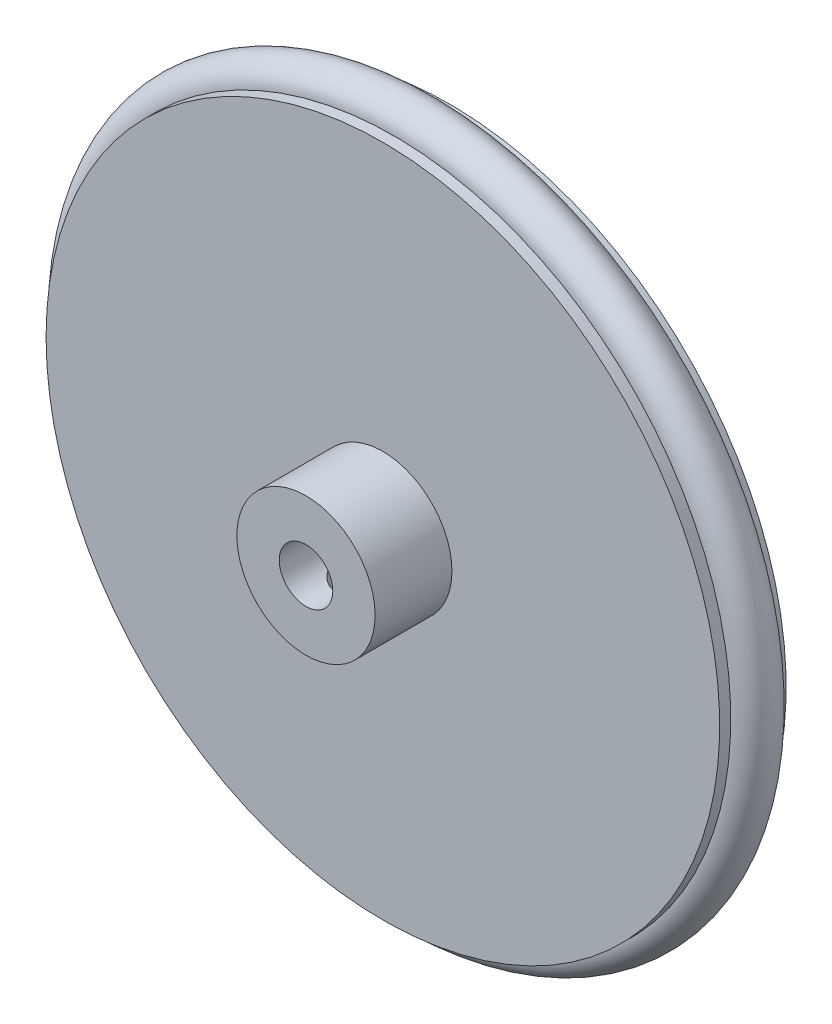
from build123d import *

# Parameters (mm, degrees)
SKETCH1_R           = 39
BOSS_EXTRUDE1_DEPTH = 3.85
SKETCH2_R           = 2.5
SKETCH4_R           = 8
BOSS_EXTRUDE2_DEPTH = 8.9
SKETCH5_R           = 3.1
CUT_EXTRUDE1_DEPTH  = 15.6
SKETCH6_R           = 2
CUT_EXTRUDE2_DEPTH  = 57.608855314
SKETCH3_R           = 2.561236926


with BuildPart() as part:
    # Sketch1 → Boss-Extrude1 (new, symmetric)
    with BuildSketch(Plane.XY):
        with Locations(Location((0, 0, 0), (0, 0, 180))):
            Circle(SKETCH1_R)
    extrude(amount=BOSS_EXTRUDE1_DEPTH, both=True)

    # Cut-Sweep1: sweep along a curve in space
    with BuildLine() as cut_sweep1_path:
        ThreePointArc((39, 0, -3.85), (27.577164466, 27.577164466, -3.85), (0, 39, -3.85))
        ThreePointArc((0, 39, -3.85), (-27.577164466, 27.577164466, -3.85), (-39, 0, -3.85))
        ThreePointArc((-39, 0, -3.85), (-27.577164466, -27.577164466, -3.85), (0, -39, -3.85))
        ThreePointArc((0, -39, -3.85), (27.577164466, -27.577164466, -3.85), (39, 0, -3.85))
    # Sketch2 → Cut-Sweep1 (sweep, cut)
    with BuildSketch(Plane(origin=(0, 0, 0), x_dir=(1, 0, 0), z_dir=(0, 1, 0))):
        with Locations((39, 0)):
            Circle(SKETCH2_R)
    sweep(path=cut_sweep1_path.line, mode=Mode.SUBTRACT)

    # Sketch4 → Boss-Extrude2 (add)
    with BuildSketch(Plane.XY.offset(3.85)):
        Circle(SKETCH4_R)
    extrude(amount=BOSS_EXTRUDE2_DEPTH)

    # Sketch5 → Cut-Extrude1 (cut)
    with BuildSketch(Plane.XY.offset(12.75)):
        Circle(SKETCH5_R)
    extrude(amount=-CUT_EXTRUDE1_DEPTH, mode=Mode.SUBTRACT)

    # Sketch6 → Cut-Extrude2 (cut, through all)
    with BuildSketch(Plane(origin=(0, 0, 0), x_dir=(1, 0, 0), z_dir=(0, 1, 0))):
        with Locations(Location((0, -7.5, 0), (0, 0, 270))):
            Circle(SKETCH6_R)
    extrude(amount=-CUT_EXTRUDE2_DEPTH, mode=Mode.SUBTRACT)

    # Sketch3 → Revolve1 (revolve)
    with BuildSketch(Plane(origin=(0, 0, 0), x_dir=(1, 0, 0), z_dir=(0, 1, 0)), mode=Mode.PRIVATE) as revolve1_sk:
        with Locations((39, 0)):
            Circle(SKETCH3_R)
    revolve(revolve1_sk.sketch.rotate(Axis((0, 0, 12.75), (0, 0, -1)), 180), axis=Axis((0, 0, 12.75), (0, 0, -1)))


solid = part.part
